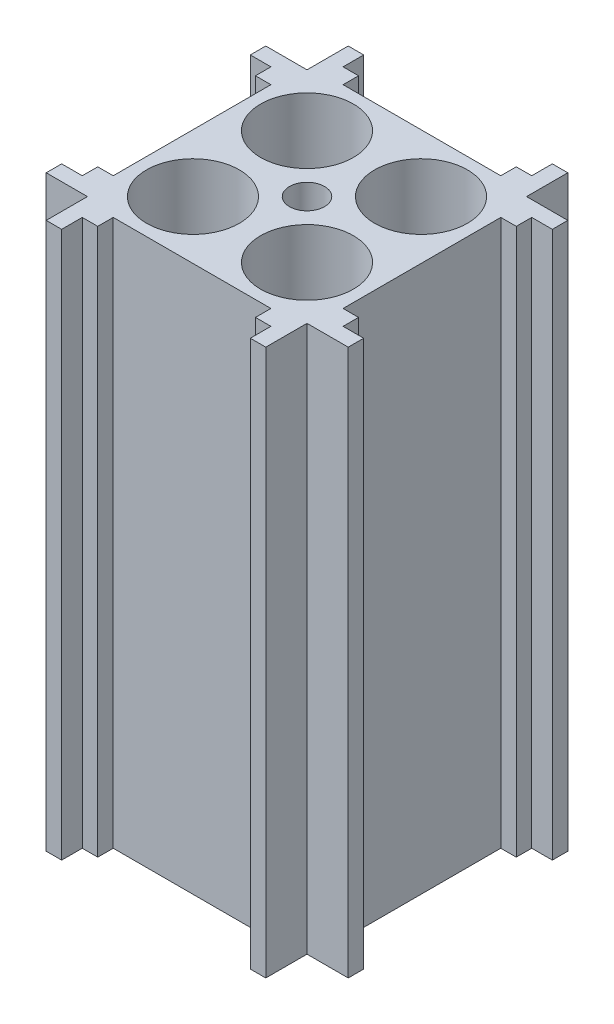
from build123d import *

# Parameters (mm, degrees)
SKETCH1_R           = 4.5
BOSS_EXTRUDE1_DEPTH = 53


with BuildPart() as part:
    # Sketch1 → Boss-Extrude1 (new body)
    with BuildSketch(Plane(origin=(0, 0, 0), x_dir=(1, 0, 0), z_dir=(0, 1, 0))):
        Polygon((-9.15, 14.65), (-10.65, 14.65), (-10.65, 10.65), (-14.65, 10.65), (-14.65, 9.15), (-12.65, 9.15), (-12.65, 7.65), (-11.15, 7.65), (-11.15, 0), (-11.15, -7.65), (-12.65, -7.65), (-12.65, -9.15), (-14.65, -9.15), (-14.65, -10.65), (-10.65, -10.65), (-10.65, -14.65), (-9.15, -14.65), (-9.15, -12.65), (-7.65, -12.65), (-7.65, -11.15), (0, -11.15), (7.65, -11.15), (7.65, -12.65), (9.15, -12.65), (9.15, -14.65), (10.65, -14.65), (10.65, -10.65), (14.65, -10.65), (14.65, -9.15), (12.65, -9.15), (12.65, -7.65), (11.15, -7.65), (11.15, 0), (11.15, 7.65), (12.65, 7.65), (12.65, 9.15), (14.65, 9.15), (14.65, 10.65), (10.65, 10.65), (10.65, 14.65), (9.15, 14.65), (9.15, 12.65), (7.65, 12.65), (7.65, 11.15), (0, 11.15), (-7.65, 11.15), (-7.65, 12.65), (-9.15, 12.65), align=None)
        with Locations((-5.531430712, -5.531430712)):
            Circle(SKETCH1_R, mode=Mode.SUBTRACT)
        with Locations((5.531430712, -5.531430712)):
            Circle(SKETCH1_R, mode=Mode.SUBTRACT)
        with Locations((-5.531430712, 5.531430712)):
            Circle(SKETCH1_R, mode=Mode.SUBTRACT)
        with BuildLine():
            ThreePointArc((0, -1.7), (-1.202081528, -1.202081528), (-1.7, 0))
            ThreePointArc((-1.7, 0), (-1.202081528, 1.202081528), (0, 1.7))
            ThreePointArc((0, 1.7), (1.202081528, 1.202081528), (1.7, 0))
            ThreePointArc((1.7, 0), (1.202081528, -1.202081528), (0, -1.7))
        make_face(mode=Mode.SUBTRACT)
        with Locations((5.531430712, 5.531430712)):
            Circle(SKETCH1_R, mode=Mode.SUBTRACT)
    extrude(amount=BOSS_EXTRUDE1_DEPTH)


solid = part.part
